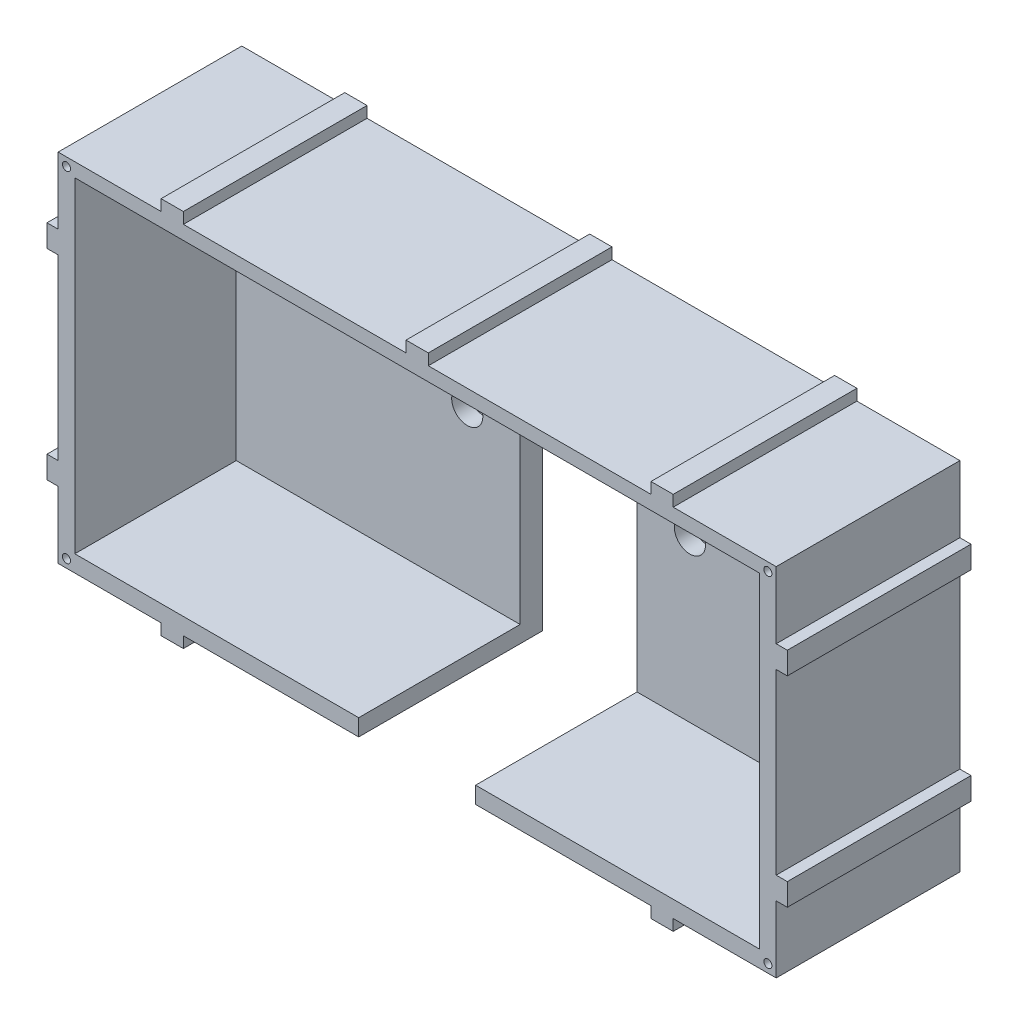
from build123d import *

# Parameters (mm, degrees)
MODEL_R             = 1.6
EXTRUDE_1_DEPTH     = 4
CUT_EXTRUDE_START   = -3
SKETCH_2_R          = 2.8
SKETCH_2_R_2        = 1.6
CUT_EXTRUDE_1_DEPTH = 3
EXTRUDE_2_DEPTH     = 29
SKETCH_6_R          = 0.725
CUT_EXTRUDE_2_DEPTH = 7


with BuildPart() as part:
    # Model → 凸台-拉伸1 (new body)
    with BuildSketch(Plane.XY):
        Polygon((257.555719115, 185.180286748), (276.055719115, 185.180286748), (276.055719115, 187.180286748), (280.055719115, 187.180286748), (280.055719115, 185.180286748), (320.055719115, 185.180286748), (320.055719115, 187.180286748), (324.055719115, 187.180286748), (324.055719115, 185.180286748), (364.055719115, 185.180286748), (364.055719115, 187.180286748), (368.055719115, 187.180286748), (368.055719115, 185.180286748), (386.555719115, 185.180286748), (386.555719115, 173.180286748), (388.555719115, 173.180286748), (388.555719115, 169.180286748), (386.555719115, 169.180286748), (386.555719115, 137.180286748), (388.555719115, 137.180286748), (388.555719115, 133.180286748), (386.555719115, 133.180286748), (386.555719115, 121.180286748), (368.055719115, 121.180286748), (368.055719115, 119.180286748), (364.055719115, 119.180286748), (364.055719115, 121.180286748), (332.555719115, 121.180286748), (332.555719115, 182.680286748), (311.555719115, 182.680286748), (311.555719115, 121.180286748), (280.055719115, 121.180286748), (280.055719115, 119.180286748), (276.055719115, 119.180286748), (276.055719115, 121.180286748), (257.555719115, 121.180286748), (257.555719115, 133.180286748), (255.555719115, 133.180286748), (255.555719115, 137.180286748), (257.555719115, 137.180286748), (257.555719115, 169.180286748), (255.555719115, 169.180286748), (255.555719115, 173.180286748), (257.555719115, 173.180286748), align=None)
        with Locations((342.055719115, 153.180286748)):
            Circle(MODEL_R, mode=Mode.SUBTRACT)
        with Locations((302.055719115, 153.180286748)):
            Circle(MODEL_R, mode=Mode.SUBTRACT)
    extrude(amount=EXTRUDE_1_DEPTH)

    # 草图2 → 切除-拉伸1 (cut)
    # profile 1 of 2: a face of its own
    with BuildSketch(Plane.XY.offset(4).offset(CUT_EXTRUDE_START)):
        with Locations((302.055719115, 153.180286748)):
            Circle(SKETCH_2_R)
        with Locations((302.055719115, 153.180286748)):
            Circle(SKETCH_2_R_2, mode=Mode.SUBTRACT)
    # profile 2 of 2: a face of its own
    with BuildSketch(Plane.XY.offset(4).offset(CUT_EXTRUDE_START)):
        with Locations((342.055719115, 153.180286748)):
            Circle(SKETCH_2_R)
        with Locations((342.055719115, 153.180286748)):
            Circle(SKETCH_2_R_2, mode=Mode.SUBTRACT)
    extrude(amount=CUT_EXTRUDE_1_DEPTH, mode=Mode.SUBTRACT)

    # 草图3 → 凸台-拉伸2 (add)
    with BuildSketch(Plane.XY.offset(4)):
        Polygon((260.555719115, 182.680286748), (260.555719115, 124.180286748), (311.555719115, 124.180286748), (311.555719115, 121.180286748), (280.055719115, 121.180286748), (280.055719115, 119.180286748), (276.055719115, 119.180286748), (276.055719115, 121.180286748), (257.555719115, 121.180286748), (257.555719115, 133.180286748), (255.555719115, 133.180286748), (255.555719115, 137.180286748), (257.555719115, 137.180286748), (257.555719115, 169.180286748), (255.555719115, 169.180286748), (255.555719115, 173.180286748), (257.555719115, 173.180286748), (257.555719115, 185.180286748), (276.055719115, 185.180286748), (276.055719115, 187.180286748), (280.055719115, 187.180286748), (280.055719115, 185.180286748), (320.055719115, 185.180286748), (320.055719115, 187.180286748), (324.055719115, 187.180286748), (324.055719115, 185.180286748), (364.055719115, 185.180286748), (364.055719115, 187.180286748), (368.055719115, 187.180286748), (368.055719115, 185.180286748), (386.555719115, 185.180286748), (386.555719115, 173.180286748), (388.555719115, 173.180286748), (388.555719115, 169.180286748), (386.555719115, 169.180286748), (386.555719115, 137.180286748), (388.555719115, 137.180286748), (388.555719115, 133.180286748), (386.555719115, 133.180286748), (386.555719115, 121.180286748), (368.055719115, 121.180286748), (368.055719115, 119.180286748), (364.055719115, 119.180286748), (364.055719115, 121.180286748), (332.555719115, 121.180286748), (332.555719115, 124.180286748), (383.555719115, 124.180286748), (383.555719115, 182.680286748), align=None)
    extrude(amount=EXTRUDE_2_DEPTH)

    # 草图6 → 切除-拉伸2 (cut)
    with BuildSketch(Plane.XY.offset(33)):
        with Locations((259.055719115, 183.680286748)):
            Circle(SKETCH_6_R)
        with Locations((385.055719115, 183.680286748)):
            Circle(SKETCH_6_R)
        with Locations((385.055719115, 122.680286748)):
            Circle(SKETCH_6_R)
        with Locations((259.055719115, 122.680286748)):
            Circle(SKETCH_6_R)
    extrude(amount=-CUT_EXTRUDE_2_DEPTH, mode=Mode.SUBTRACT)


solid = part.part
